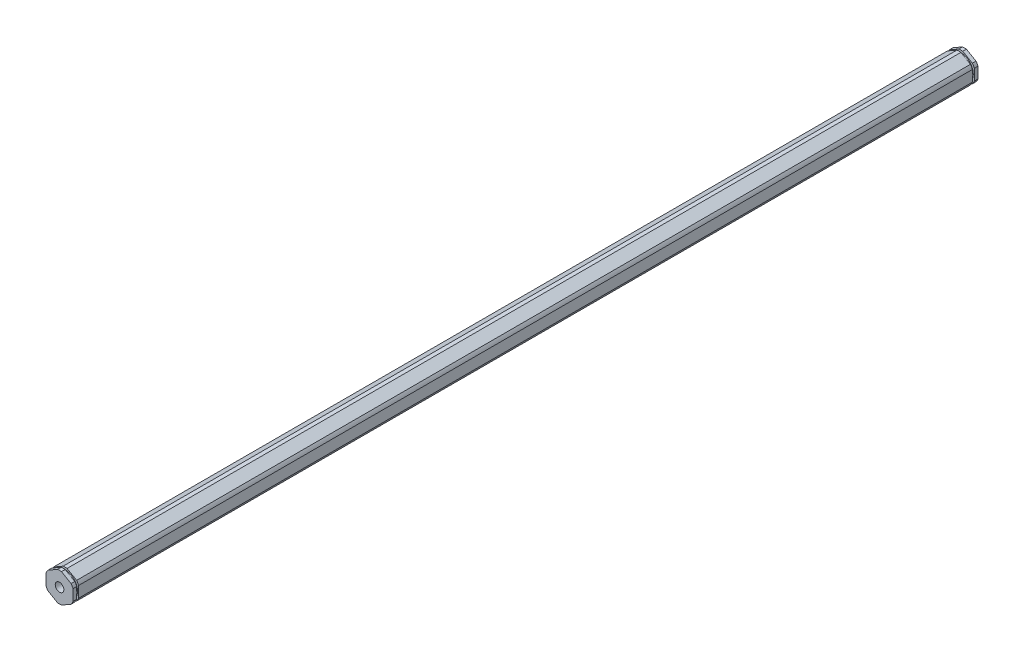
from build123d import *

# Parameters (mm, degrees)
BOSS_EXTRUDE1_DEPTH                  = 212.22335
F_10_32_TAPPED_HOLE1_D               = 4.0386
F_10_32_TAPPED_HOLE1_DEPTH           = 16.34744
F_10_32_TAPPED_HOLE1_TIP             = 1.213317848
F_10_32_TAPPED_HOLE1_ON_FACE_2_D     = 4.0386
F_10_32_TAPPED_HOLE1_ON_FACE_2_DEPTH = 16.34744
F_10_32_TAPPED_HOLE1_ON_FACE_2_TIP   = 1.213317848
SKETCH5_W                            = 0.889
SKETCH5_H                            = 1.0033


with BuildPart() as part:
    # Sketch1 → Boss-Extrude1 (new, symmetric)
    with BuildSketch(Plane.XY):
        with BuildLine():
            ThreePointArc((0.93173274, 6.79441227), (0, 6.858), (-0.93173274, 6.79441227))
            Line((-0.93173274, 6.79441227), (-5.41826726, 4.204110358))
            ThreePointArc((-5.41826726, 4.204110358), (-5.939202219, 3.429), (-6.35, 2.590301913))
            Line((-6.35, 2.590301913), (-6.35, -2.590301913))
            ThreePointArc((-6.35, -2.590301913), (-5.939202219, -3.429), (-5.41826726, -4.204110358))
            Line((-5.41826726, -4.204110358), (-0.93173274, -6.79441227))
            ThreePointArc((-0.93173274, -6.79441227), (0, -6.858), (0.93173274, -6.79441227))
            Line((0.93173274, -6.79441227), (5.41826726, -4.204110358))
            ThreePointArc((5.41826726, -4.204110358), (5.939202219, -3.429), (6.35, -2.590301913))
            Line((6.35, -2.590301913), (6.35, 2.590301913))
            ThreePointArc((6.35, 2.590301913), (5.939202219, 3.429), (5.41826726, 4.204110358))
            Line((5.41826726, 4.204110358), (0.93173274, 6.79441227))
        make_face()
    extrude(amount=BOSS_EXTRUDE1_DEPTH, both=True)

    # #10-32 Tapped Hole1
    with Locations(Plane.XY.offset(212.22335)):
        with Locations((0, 0)):
            Hole(F_10_32_TAPPED_HOLE1_D / 2, depth=F_10_32_TAPPED_HOLE1_DEPTH)
            with Locations((0, 0, -(F_10_32_TAPPED_HOLE1_DEPTH + F_10_32_TAPPED_HOLE1_TIP / 2))):  # 118° drill point
                Cone(0, F_10_32_TAPPED_HOLE1_D / 2, F_10_32_TAPPED_HOLE1_TIP, mode=Mode.SUBTRACT)

    # #10-32 Tapped Hole1 on face 2
    with Locations(Plane(origin=(0, 0, -212.22335), x_dir=(-1, 0, 0), z_dir=(0, 0, -1))):
        with Locations((0, 0)):
            Hole(F_10_32_TAPPED_HOLE1_ON_FACE_2_D / 2, depth=F_10_32_TAPPED_HOLE1_ON_FACE_2_DEPTH)
            with Locations((0, 0, -(F_10_32_TAPPED_HOLE1_ON_FACE_2_DEPTH + F_10_32_TAPPED_HOLE1_ON_FACE_2_TIP / 2))):  # 118° drill point
                Cone(0, F_10_32_TAPPED_HOLE1_ON_FACE_2_D / 2, F_10_32_TAPPED_HOLE1_ON_FACE_2_TIP, mode=Mode.SUBTRACT)

    # Sketch5 → Cut-Revolve1 (revolve, cut)
    with BuildSketch(Plane(origin=(0, 0, 0), x_dir=(0, 0, -1), z_dir=(1, 0, 0)), mode=Mode.PRIVATE) as cut_revolve1_sk:
        with Locations((-210.06435, 6.35635)):
            Rectangle(SKETCH5_W, SKETCH5_H)
    cut_revolve1 = revolve(cut_revolve1_sk.sketch.rotate(Axis((0, 0, 165.047176272), (0, 0, -1)), 90), axis=Axis((0, 0, 165.047176272), (0, 0, -1)), mode=Mode.SUBTRACT)

    # Mirror1: Cut-Revolve1 across plane
    add(cut_revolve1.mirror(Plane.XY), mode=Mode.SUBTRACT)


solid = part.part
